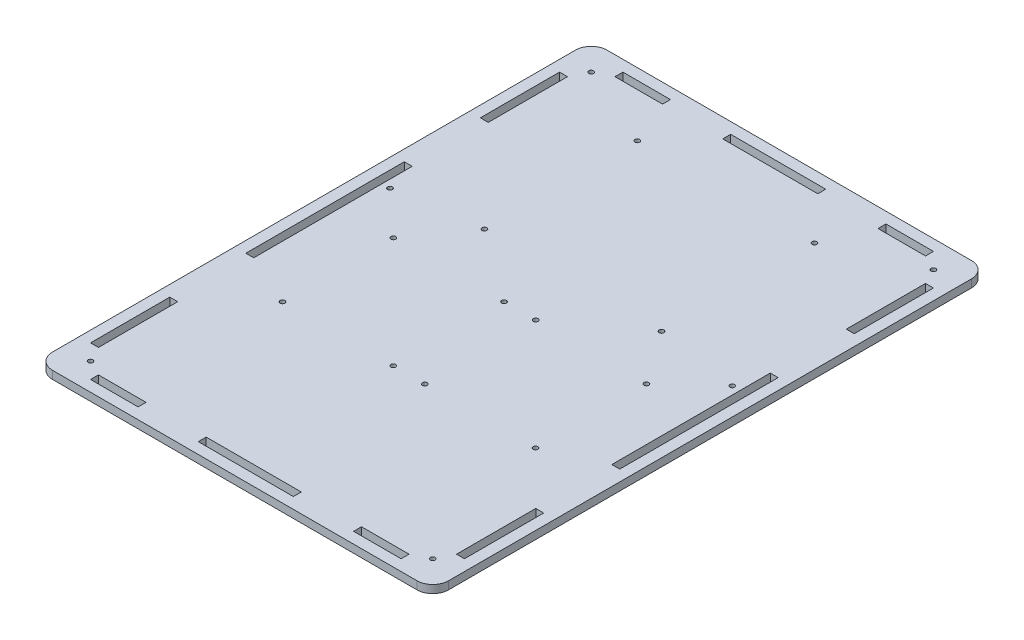
from build123d import *

# Parameters (mm, degrees)
SKETCH1_R           = 1.5
SKETCH1_W           = 30
SKETCH1_H           = 5
SKETCH1_W_2         = 5
SKETCH1_H_2         = 50
SKETCH1_W_3         = 60
SKETCH1_H_3         = 100
BOSS_EXTRUDE1_DEPTH = 5


with BuildPart() as part:
    # Sketch1 → Boss-Extrude1 (new body)
    # profile 1 of 2: a face of its own
    with BuildSketch(Plane(origin=(0, 0, 0), x_dir=(1, 0, 0), z_dir=(0, 1, 0))):
        with BuildLine():
            ThreePointArc((0, 10), (2.928932188, 2.928932188), (10, 0))
            Line((10, 0), (240, 0))
            ThreePointArc((240, 0), (247.071067812, 2.928932188), (250, 10))
            Line((250, 10), (250, 340))
            ThreePointArc((250, 340), (247.071067812, 347.071067812), (240, 350))
            Line((240, 350), (10, 350))
            ThreePointArc((10, 350), (2.928932188, 347.071067812), (0, 340))
            Line((0, 340), (0, 10))
        make_face()
        with Locations(Location((17, 17, 0), (0, 0, 270))):
            Circle(SKETCH1_R, mode=Mode.SUBTRACT)
        with Locations((42, 9.5)):
            Rectangle(SKETCH1_W, SKETCH1_H, mode=Mode.SUBTRACT)
        with Locations((9.5, 52)):
            Rectangle(SKETCH1_W_2, SKETCH1_H_2, mode=Mode.SUBTRACT)
        with Locations(Location((45.15, 110, 0), (0, 0, 270))):
            Circle(SKETCH1_R, mode=Mode.SUBTRACT)
        with Locations(Location((115, 110, 0), (0, 0, 270))):
            Circle(SKETCH1_R, mode=Mode.SUBTRACT)
        with Locations((125, 9.5)):
            Rectangle(SKETCH1_W_3, SKETCH1_H, mode=Mode.SUBTRACT)
        with Locations((208, 9.5)):
            Rectangle(SKETCH1_W, SKETCH1_H, mode=Mode.SUBTRACT)
        with Locations(Location((233, 17, 0), (0, 0, 270))):
            Circle(SKETCH1_R, mode=Mode.SUBTRACT)
        with Locations((240.5, 52)):
            Rectangle(SKETCH1_W_2, SKETCH1_H_2, mode=Mode.SUBTRACT)
        with Locations(Location((135, 110, 0), (0, 0, 270))):
            Circle(SKETCH1_R, mode=Mode.SUBTRACT)
        with Locations(Location((204.85, 110, 0), (0, 0, 270))):
            Circle(SKETCH1_R, mode=Mode.SUBTRACT)
        Polygon((7, 175), (7, 225), (12, 225), (12, 125), (7, 125), align=None, mode=Mode.SUBTRACT)
        with Locations(Location((17, 206, 0), (0, 0, 270))):
            Circle(SKETCH1_R, mode=Mode.SUBTRACT)
        with Locations(Location((45.15, 179.98, 0), (0, 0, 270))):
            Circle(SKETCH1_R, mode=Mode.SUBTRACT)
        with Locations(Location((69.12, 213.48, 0), (0, 0, 270))):
            Circle(SKETCH1_R, mode=Mode.SUBTRACT)
        with Locations(Location((115, 179.98, 0), (0, 0, 270))):
            Circle(SKETCH1_R, mode=Mode.SUBTRACT)
        with Locations((9.5, 298)):
            Rectangle(SKETCH1_W_2, SKETCH1_H_2, mode=Mode.SUBTRACT)
        with Locations(Location((17, 333, 0), (0, 0, 270))):
            Circle(SKETCH1_R, mode=Mode.SUBTRACT)
        with Locations((42, 340.5)):
            Rectangle(SKETCH1_W, SKETCH1_H, mode=Mode.SUBTRACT)
        with Locations(Location((69.12, 310, 0), (0, 0, 270))):
            Circle(SKETCH1_R, mode=Mode.SUBTRACT)
        with Locations(Location((135, 179.98, 0), (0, 0, 270))):
            Circle(SKETCH1_R, mode=Mode.SUBTRACT)
        with Locations(Location((180.88, 213.48, 0), (0, 0, 270))):
            Circle(SKETCH1_R, mode=Mode.SUBTRACT)
        with Locations(Location((204.85, 179.98, 0), (0, 0, 270))):
            Circle(SKETCH1_R, mode=Mode.SUBTRACT)
        with Locations((240.5, 175)):
            Rectangle(SKETCH1_W_2, SKETCH1_H_3, mode=Mode.SUBTRACT)
        with Locations(Location((233, 206, 0), (0, 0, 270))):
            Circle(SKETCH1_R, mode=Mode.SUBTRACT)
        Polygon((95, 343), (125, 343), (155, 343), (155, 338), (95, 338), align=None, mode=Mode.SUBTRACT)
        with Locations(Location((180.88, 310, 0), (0, 0, 270))):
            Circle(SKETCH1_R, mode=Mode.SUBTRACT)
        with Locations((240.5, 298)):
            Rectangle(SKETCH1_W_2, SKETCH1_H_2, mode=Mode.SUBTRACT)
        with Locations((208, 340.5)):
            Rectangle(SKETCH1_W, SKETCH1_H, mode=Mode.SUBTRACT)
        with Locations(Location((233, 333, 0), (0, 0, 270))):
            Circle(SKETCH1_R, mode=Mode.SUBTRACT)
    # profile 2 of 2: a face of its own
    with BuildSketch(Plane(origin=(0, 0, 0), x_dir=(1, 0, 0), z_dir=(0, 1, 0))):
        with BuildLine():
            ThreePointArc((0, 10), (2.928932188, 2.928932188), (10, 0))
            Line((10, 0), (240, 0))
            ThreePointArc((240, 0), (247.071067812, 2.928932188), (250, 10))
            Line((250, 10), (250, 340))
            ThreePointArc((250, 340), (247.071067812, 347.071067812), (240, 350))
            Line((240, 350), (10, 350))
            ThreePointArc((10, 350), (2.928932188, 347.071067812), (0, 340))
            Line((0, 340), (0, 10))
        make_face()
        with Locations(Location((17, 17, 0), (0, 0, 270))):
            Circle(SKETCH1_R, mode=Mode.SUBTRACT)
        with Locations((42, 9.5)):
            Rectangle(SKETCH1_W, SKETCH1_H, mode=Mode.SUBTRACT)
        with Locations((9.5, 52)):
            Rectangle(SKETCH1_W_2, SKETCH1_H_2, mode=Mode.SUBTRACT)
        with Locations(Location((45.15, 110, 0), (0, 0, 270))):
            Circle(SKETCH1_R, mode=Mode.SUBTRACT)
        with Locations(Location((115, 110, 0), (0, 0, 270))):
            Circle(SKETCH1_R, mode=Mode.SUBTRACT)
        with Locations((125, 9.5)):
            Rectangle(SKETCH1_W_3, SKETCH1_H, mode=Mode.SUBTRACT)
        with Locations((208, 9.5)):
            Rectangle(SKETCH1_W, SKETCH1_H, mode=Mode.SUBTRACT)
        with Locations(Location((233, 17, 0), (0, 0, 270))):
            Circle(SKETCH1_R, mode=Mode.SUBTRACT)
        with Locations((240.5, 52)):
            Rectangle(SKETCH1_W_2, SKETCH1_H_2, mode=Mode.SUBTRACT)
        with Locations(Location((135, 110, 0), (0, 0, 270))):
            Circle(SKETCH1_R, mode=Mode.SUBTRACT)
        with Locations(Location((204.85, 110, 0), (0, 0, 270))):
            Circle(SKETCH1_R, mode=Mode.SUBTRACT)
        Polygon((7, 175), (7, 225), (12, 225), (12, 125), (7, 125), align=None, mode=Mode.SUBTRACT)
        with Locations(Location((17, 206, 0), (0, 0, 270))):
            Circle(SKETCH1_R, mode=Mode.SUBTRACT)
        with Locations(Location((45.15, 179.98, 0), (0, 0, 270))):
            Circle(SKETCH1_R, mode=Mode.SUBTRACT)
        with Locations(Location((69.12, 213.48, 0), (0, 0, 270))):
            Circle(SKETCH1_R, mode=Mode.SUBTRACT)
        with Locations(Location((115, 179.98, 0), (0, 0, 270))):
            Circle(SKETCH1_R, mode=Mode.SUBTRACT)
        with Locations((9.5, 298)):
            Rectangle(SKETCH1_W_2, SKETCH1_H_2, mode=Mode.SUBTRACT)
        with Locations(Location((17, 333, 0), (0, 0, 270))):
            Circle(SKETCH1_R, mode=Mode.SUBTRACT)
        with Locations((42, 340.5)):
            Rectangle(SKETCH1_W, SKETCH1_H, mode=Mode.SUBTRACT)
        with Locations(Location((69.12, 310, 0), (0, 0, 270))):
            Circle(SKETCH1_R, mode=Mode.SUBTRACT)
        with Locations(Location((135, 179.98, 0), (0, 0, 270))):
            Circle(SKETCH1_R, mode=Mode.SUBTRACT)
        with Locations(Location((180.88, 213.48, 0), (0, 0, 270))):
            Circle(SKETCH1_R, mode=Mode.SUBTRACT)
        with Locations(Location((204.85, 179.98, 0), (0, 0, 270))):
            Circle(SKETCH1_R, mode=Mode.SUBTRACT)
        with Locations((240.5, 175)):
            Rectangle(SKETCH1_W_2, SKETCH1_H_3, mode=Mode.SUBTRACT)
        with Locations(Location((233, 206, 0), (0, 0, 270))):
            Circle(SKETCH1_R, mode=Mode.SUBTRACT)
        Polygon((95, 343), (125, 343), (155, 343), (155, 338), (95, 338), align=None, mode=Mode.SUBTRACT)
        with Locations(Location((180.88, 310, 0), (0, 0, 270))):
            Circle(SKETCH1_R, mode=Mode.SUBTRACT)
        with Locations((240.5, 298)):
            Rectangle(SKETCH1_W_2, SKETCH1_H_2, mode=Mode.SUBTRACT)
        with Locations((208, 340.5)):
            Rectangle(SKETCH1_W, SKETCH1_H, mode=Mode.SUBTRACT)
        with Locations(Location((233, 333, 0), (0, 0, 270))):
            Circle(SKETCH1_R, mode=Mode.SUBTRACT)
    extrude(amount=BOSS_EXTRUDE1_DEPTH)


solid = part.part
